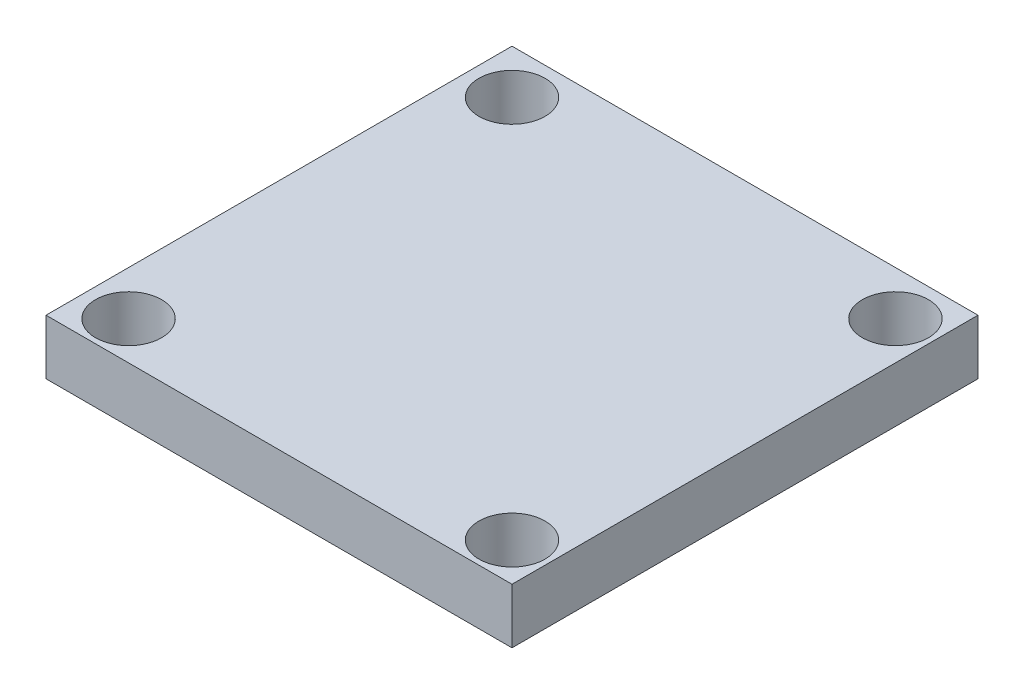
from build123d import *

# Parameters (mm, degrees)
SKETCH1_W           = 42.3
SKETCH1_H           = 42.3
BOSS_EXTRUDE2_DEPTH = 5
SKETCH2_R           = 3
CUT_EXTRUDE1_DEPTH  = 5
CIRPATTERN1_COUNT   = 4


with BuildPart() as part:
    # Sketch1 → Boss-Extrude2 (new body)
    with BuildSketch(Plane(origin=(0, 0, 0), x_dir=(1, 0, 0), z_dir=(0, 1, 0))):
        Rectangle(SKETCH1_W, SKETCH1_H)
    extrude(amount=BOSS_EXTRUDE2_DEPTH)

    # Sketch2 → Cut-Extrude1 (cut)
    with BuildSketch(Plane(origin=(0, 5, 0), x_dir=(1, 0, 0), z_dir=(0, 1, 0))):
        with Locations(Location((-17.127358159, 17.127358159, 0), (0, 0, 270))):
            Circle(SKETCH2_R)
    cut_extrude1 = extrude(amount=-CUT_EXTRUDE1_DEPTH, mode=Mode.SUBTRACT)

    # CirPattern1: Cut-Extrude1 ×4 about axis
    cirpattern1_axis = Axis((0.274991672, 0, 0.274991672), (0, 1, 0))
    for i in range(1, CIRPATTERN1_COUNT):
        add(cut_extrude1.rotate(cirpattern1_axis, i * 360 / CIRPATTERN1_COUNT), mode=Mode.SUBTRACT)


solid = part.part
